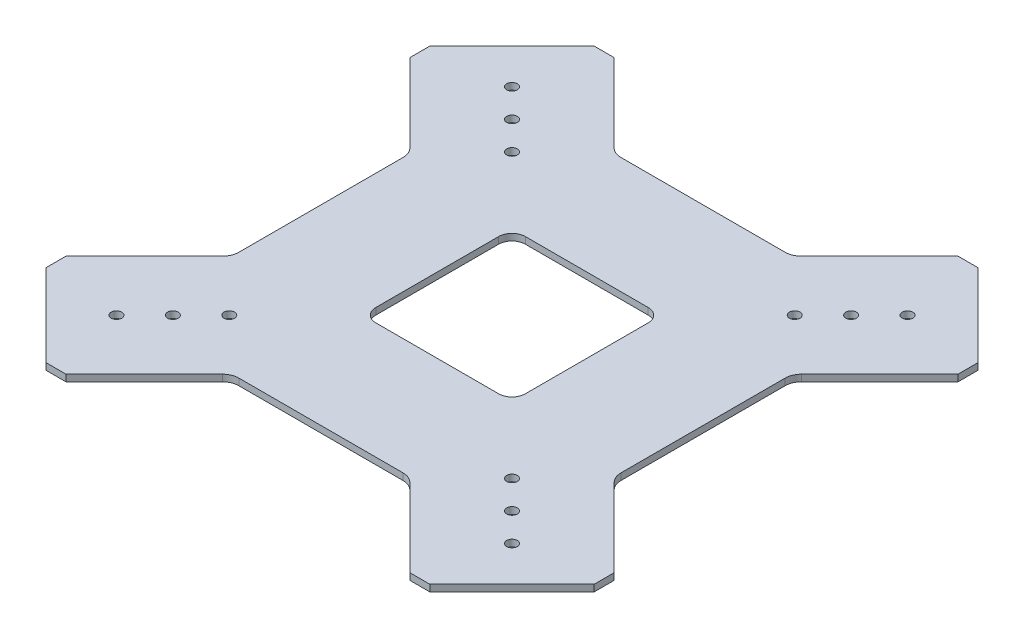
from build123d import *

# Parameters (mm, degrees)
BOSS_EXTRUDE1_DEPTH  = 2
SKETCH2_W            = 45
SKETCH2_H            = 45
CUT_EXTRUDE1_DEPTH   = 117.689759619
FILLET1_R            = 4
CUT_EXTRUDE2_DEPTH   = 117.689759619
FILLET2_R            = 5
M3_CLEARANCE_HOLE1_D = 3.2


with BuildPart() as part:
    # Sketch1 → Boss-Extrude1 (new body)
    with BuildSketch(Plane(origin=(0, 0, 0), x_dir=(1, 0, 0), z_dir=(0, 1, 0))):
        Polygon((-57.751262658, 82.5), (-82.5, 57.751262658), (-82.5, -57.751262658), (-57.751262658, -82.5), (57.751262658, -82.5), (82.5, -57.751262658), (82.5, 57.751262658), (57.751262658, 82.5), align=None)
    extrude(amount=BOSS_EXTRUDE1_DEPTH)

    # Sketch2 → Cut-Extrude1 (cut, through all)
    with BuildSketch(Plane(origin=(0, 2, 0), x_dir=(1, 0, 0), z_dir=(0, 1, 0))):
        Rectangle(SKETCH2_W, SKETCH2_H)
    extrude(amount=-CUT_EXTRUDE1_DEPTH, mode=Mode.SUBTRACT)

    # Fillet1
    fillet1_edges = [part.edges().sort_by_distance(p)[0] for p in [
        (22.5, 1, -22.5),
        (22.5, 1, 22.5),
        (-22.5, 1, 22.5),
        (-22.5, 1, -22.5),
    ]]
    fillet(fillet1_edges, radius=FILLET1_R)

    # Sketch3 → Cut-Extrude2 (cut, through all)
    with BuildSketch(Plane(origin=(0, 2, 0), x_dir=(1, 0, 0), z_dir=(0, 1, 0))):
        Polygon((57.5, -26.751262658), (82.5, -51.751262658), (82.5, 51.751262658), (57.5, 26.751262658), align=None)
        Polygon((-51.751262658, -82.5), (51.751262658, -82.5), (26.751262658, -57.5), (-26.751262658, -57.5), align=None)
        Polygon((-57.5, 26.751262658), (-82.5, 51.751262658), (-82.5, -51.751262658), (-57.5, -26.751262658), align=None)
        Polygon((26.751262658, 57.5), (51.751262658, 82.5), (-51.751262658, 82.5), (-26.751262658, 57.5), align=None)
    extrude(amount=-CUT_EXTRUDE2_DEPTH, mode=Mode.SUBTRACT)

    # Fillet2
    fillet2_edges = [part.edges().sort_by_distance(p)[0] for p in [
        (-26.751262658, 1, -57.5),
        (26.751262658, 1, -57.5),
        (57.5, 1, 26.751262658),
        (57.5, 1, -26.751262658),
        (-26.751262658, 1, 57.5),
        (26.751262658, 1, 57.5),
        (-57.5, 1, -26.751262658),
        (-57.5, 1, 26.751262658),
    ]]
    fillet(fillet2_edges, radius=FILLET2_R)

    # M3 Clearance Hole1 (through all)
    with Locations(Plane(origin=(0, 0, 0), x_dir=(-1, 0, 0), z_dir=(0, -1, 0))):
        with Locations((-59.519029611, 59.519029611), (59.519029611, -59.519029611), (51.033748237, -51.033748237), (42.548466863, -42.548466863), (-59.519029611, -59.519029611), (-51.033748237, -51.033748237), (-42.548466863, -42.548466863), (59.519029611, 59.519029611), (51.033748237, 51.033748237), (42.548466863, 42.548466863), (-42.548466863, 42.548466863), (-51.033748237, 51.033748237)):
            Hole(M3_CLEARANCE_HOLE1_D / 2)


solid = part.part
